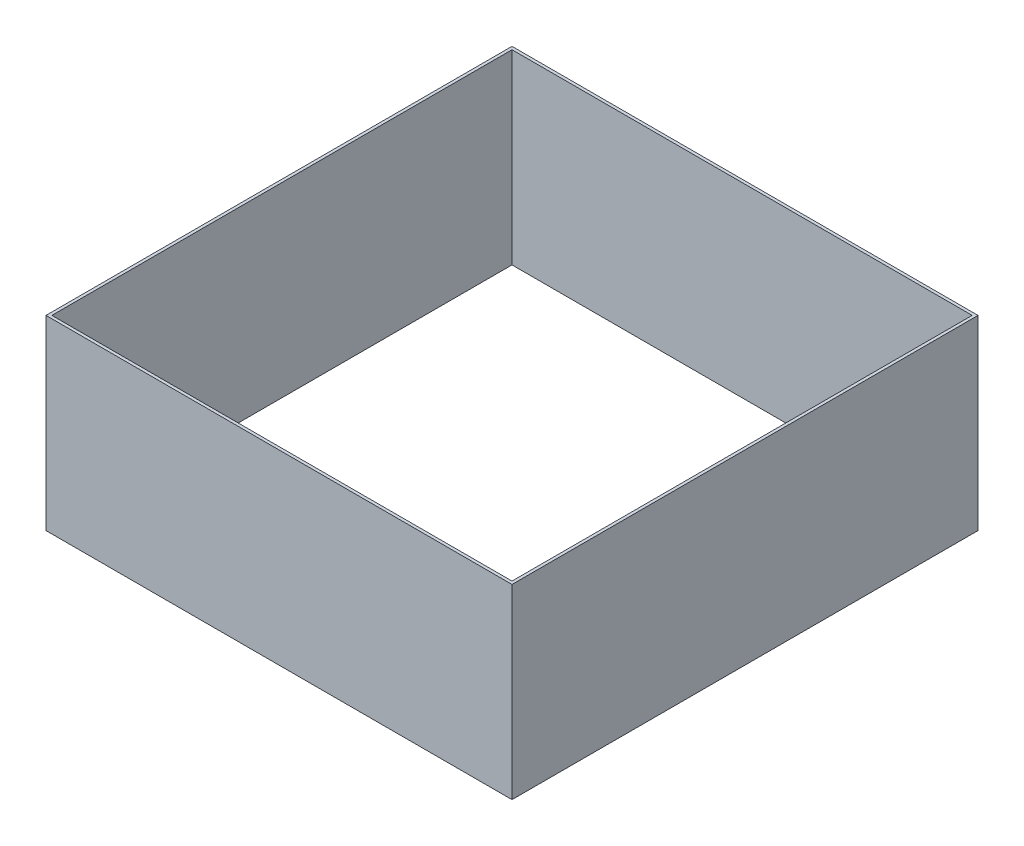
from build123d import *

# Parameters (mm, degrees)
SKETCH2_W           = 40
SKETCH2_H           = 40
SKETCH2_W_2         = 39.5
SKETCH2_H_2         = 39.5
BOSS_EXTRUDE4_DEPTH = 16


with BuildPart() as part:
    # Sketch2 → Boss-Extrude4 (new body)
    with BuildSketch(Plane(origin=(0, 0, 0), x_dir=(1, 0, 0), z_dir=(0, 1, 0))):
        with Locations((20, 20)):
            Rectangle(SKETCH2_W, SKETCH2_H)
        with Locations((20, 20)):
            Rectangle(SKETCH2_W_2, SKETCH2_H_2, mode=Mode.SUBTRACT)
    extrude(amount=BOSS_EXTRUDE4_DEPTH)


solid = part.part
